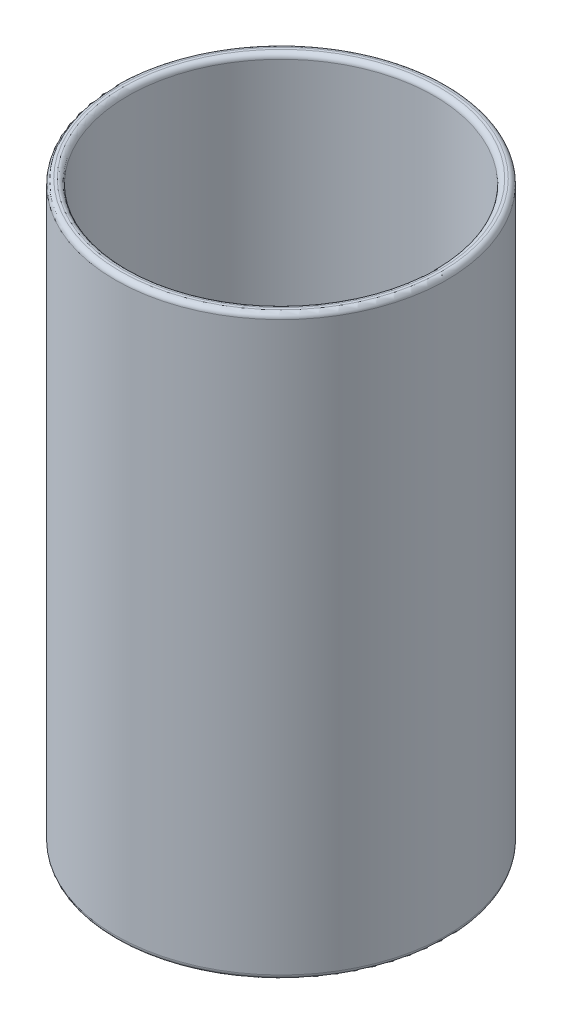
from build123d import *

# Parameters (mm, degrees)
SKETCH2_R           = 33
SKETCH2_R_2         = 30.5
BOSS_EXTRUDE1_DEPTH = 115
FILLET1_R           = 1


with BuildPart() as part:
    # Sketch2 → Boss-Extrude1 (new body)
    with BuildSketch(Plane(origin=(0, 0, 0), x_dir=(1, 0, 0), z_dir=(0, 1, 0))):
        with Locations(Location((0, 0, 0), (0, 0, 270))):
            Circle(SKETCH2_R)
        with Locations(Location((0, 0, 0), (0, 0, 270))):
            Circle(SKETCH2_R_2, mode=Mode.SUBTRACT)
    extrude(amount=BOSS_EXTRUDE1_DEPTH)

    # Fillet1
    fillet1_edges = [part.edges().sort_by_distance(p)[0] for p in [
        (0, 0, -33),
        (0, 115, -33),
        (0, 0, -30.5),
        (0, 115, -30.5),
    ]]
    fillet(fillet1_edges, radius=FILLET1_R)


solid = part.part
